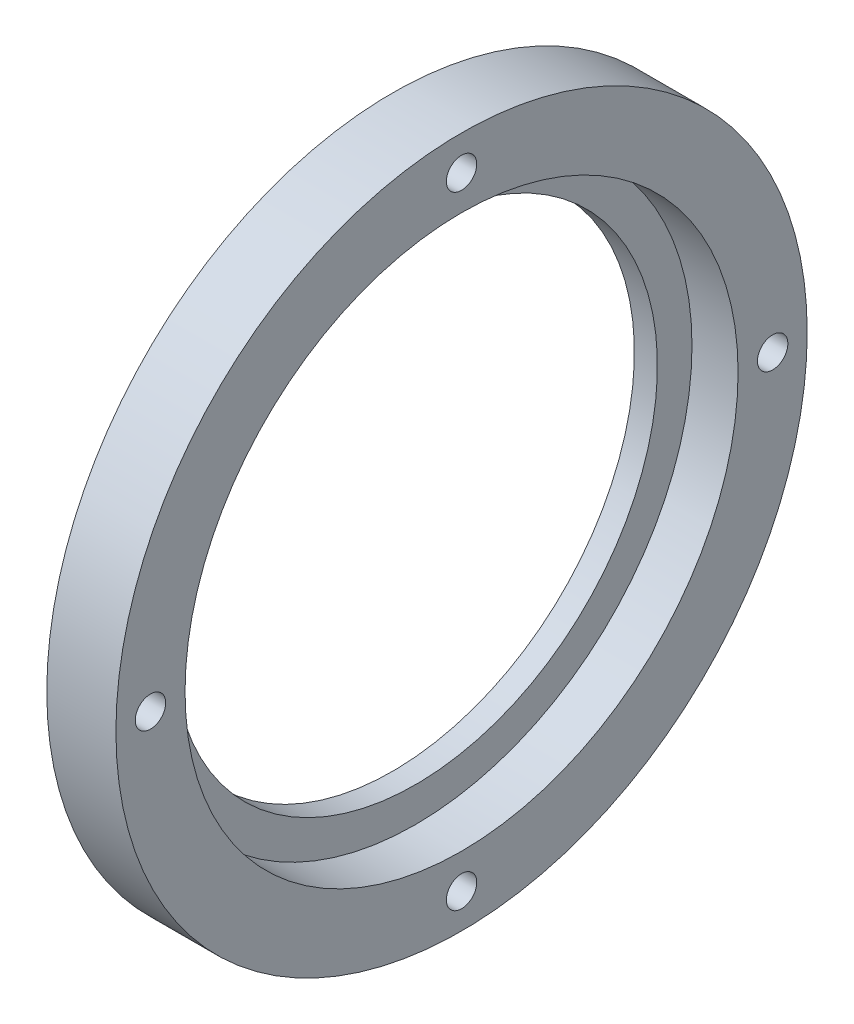
from build123d import *

# Parameters (mm, degrees)
PER_AGE1_D = 6.6


with BuildPart() as part:
    # Esquisse1 → Base-Révolution (revolve)
    with BuildSketch(Plane.XY, mode=Mode.PRIVATE) as base_r_volution_sk:
        Polygon((0, 52.5), (0, 75), (15, 75), (15, 60), (5, 60), (5, 52.5), align=None)
    revolve(base_r_volution_sk.sketch.rotate(Axis((-16.708877928, 0, 0), (1, 0, 0)), 90), axis=Axis((-16.708877928, 0, 0), (1, 0, 0)))

    # Perçage1 (through all)
    with Locations(Plane.ZY):
        with Locations((0, 67.5), (67.5, 0), (0, -67.5), (-67.5, 0)):
            Hole(PER_AGE1_D / 2)


solid = part.part
